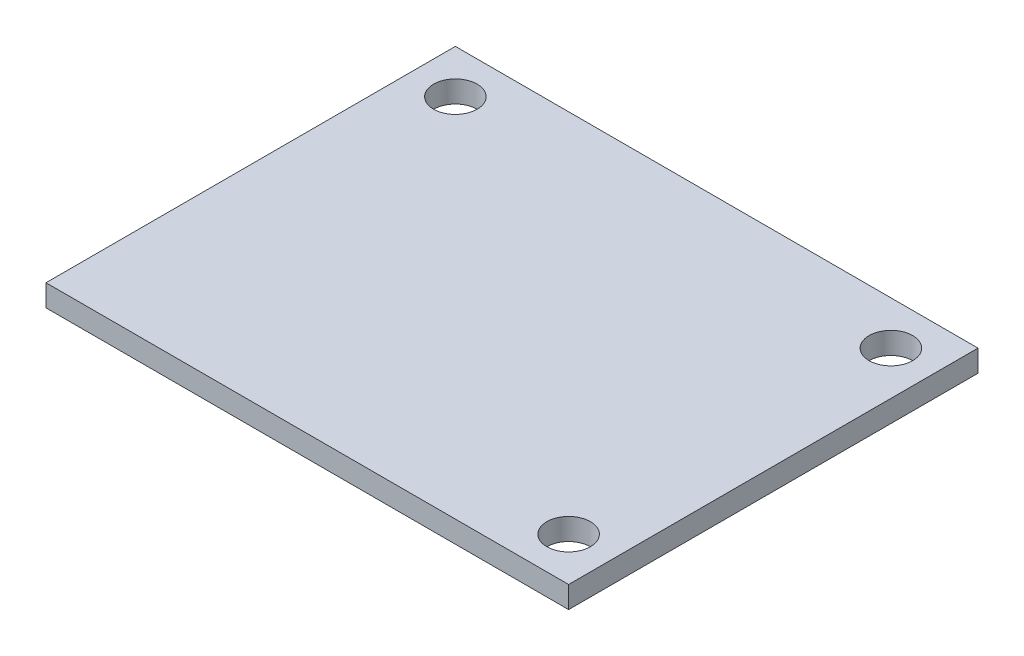
from build123d import *

# Parameters (mm, degrees)
SKETCH1_W           = 38.1
SKETCH1_H           = 29.845
BOSS_EXTRUDE1_DEPTH = 1.5875
SKETCH2_R           = 1.5875
CUT_EXTRUDE1_DEPTH  = 25.250848696


with BuildPart() as part:
    # Sketch1 → Boss-Extrude1 (new body)
    with BuildSketch(Plane(origin=(0, 0, 0), x_dir=(1, 0, 0), z_dir=(0, 1, 0))):
        Rectangle(SKETCH1_W, SKETCH1_H)
    extrude(amount=BOSS_EXTRUDE1_DEPTH)

    # Sketch2 → Cut-Extrude1 (cut, through all)
    with BuildSketch(Plane(origin=(0, 1.5875, 0), x_dir=(1, 0, 0), z_dir=(0, 1, 0))):
        with Locations(Location((-15.875, 11.7475, 0), (0, 0, 270))):
            Circle(SKETCH2_R)
        with Locations(Location((15.875, 11.7475, 0), (0, 0, 270))):
            Circle(SKETCH2_R)
        with Locations(Location((15.875, -11.7475, 0), (0, 0, 270))):
            Circle(SKETCH2_R)
    extrude(amount=-CUT_EXTRUDE1_DEPTH, mode=Mode.SUBTRACT)


solid = part.part
